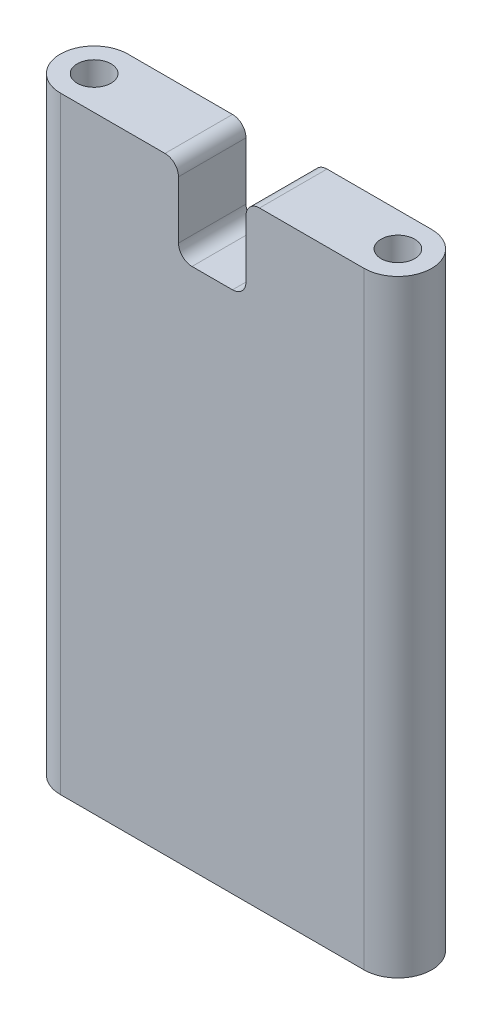
from build123d import *

# Parameters (mm, degrees)
SKETCH2_R           = 3.175
BOSS_EXTRUDE1_DEPTH = 57.15
SKETCH7_W           = 12.7
SKETCH7_H           = 15.875
CUT_EXTRUDE3_DEPTH  = 69.170141008
FILLET1_R           = 2.54


with BuildPart() as part:
    # Sketch2 → Boss-Extrude1 (new, symmetric)
    with BuildSketch(Plane(origin=(0, 0, 0), x_dir=(1, 0, 0), z_dir=(0, 1, 0))):
        with BuildLine():
            Line((-28.575, 6.35), (28.575, 6.35))
            ThreePointArc((28.575, 6.35), (34.925, 0), (28.575, -6.35))
            Line((28.575, -6.35), (-28.575, -6.35))
            ThreePointArc((-28.575, -6.35), (-34.925, 0), (-28.575, 6.35))
        make_face()
        with Locations(Location((28.575, 0, 0), (0, 0, 270))):
            Circle(SKETCH2_R, mode=Mode.SUBTRACT)
        with Locations(Location((-28.575, 0, 0), (0, 0, 270))):
            Circle(SKETCH2_R, mode=Mode.SUBTRACT)
    extrude(amount=BOSS_EXTRUDE1_DEPTH, both=True)

    # Sketch7 → Cut-Extrude3 (cut, through all)
    with BuildSketch(Plane.XY.offset(6.35)):
        with Locations((0, 49.2125)):
            Rectangle(SKETCH7_W, SKETCH7_H)
    extrude(amount=-CUT_EXTRUDE3_DEPTH, mode=Mode.SUBTRACT)

    # Fillet1
    fillet1_edges = [part.edges().sort_by_distance(p)[0] for p in [
        (-6.35, 57.15, 0),
        (6.35, 57.15, 0),
        (6.35, 41.275, 0),
        (-6.35, 41.275, 0),
    ]]
    fillet(fillet1_edges, radius=FILLET1_R)


solid = part.part
